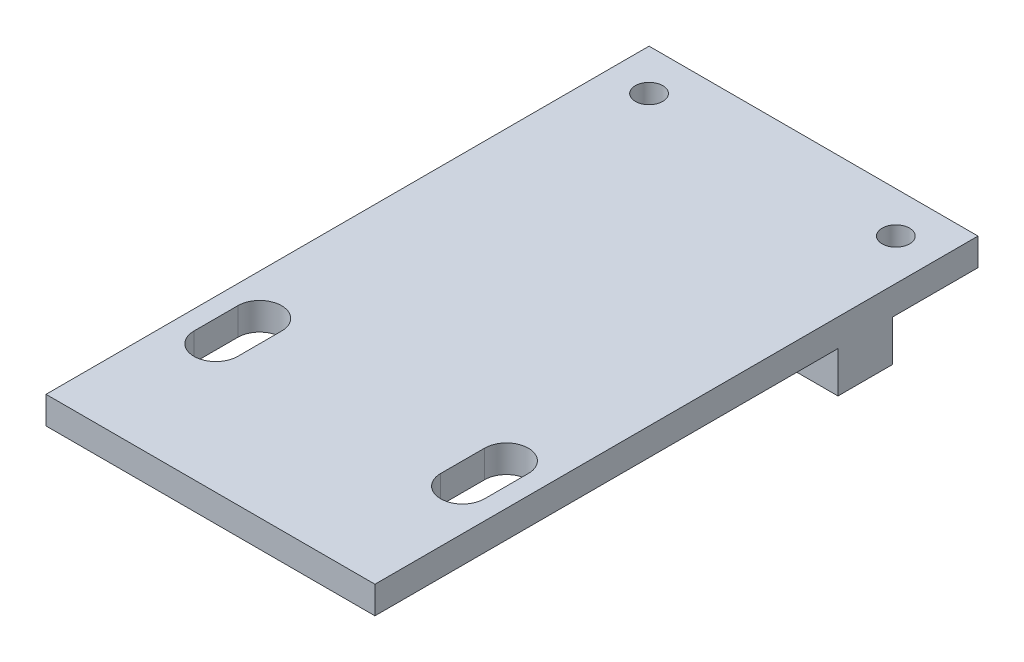
from build123d import *

# Parameters (mm, degrees)
SKETCH1_W           = 24
SKETCH1_H           = 48
BOSS_EXTRUDE1_DEPTH = 2
SKETCH2_R           = 1
CUT_EXTRUDE1_DEPTH  = 2
SKETCH3_R           = 1.6
CUT_EXTRUDE2_DEPTH  = 2
SKETCH5_W           = 4.002629444
SKETCH5_H           = 28.892829006
BOSS_EXTRUDE2_DEPTH = 3
SKETCH7_W           = 4.002629444
SKETCH7_H           = 6.221455563
CUT_EXTRUDE3_DEPTH  = 3
SKETCH8_W           = 10.000621013
SKETCH8_H           = 3.995270277
SKETCH8_W_2         = 9.996749543
BOSS_EXTRUDE3_DEPTH = 3
SKETCH9_W           = 24
SKETCH9_H           = 2
CUT_EXTRUDE4_DEPTH  = 4


with BuildPart() as part:
    # Sketch1 → Boss-Extrude1 (new body)
    with BuildSketch(Plane(origin=(0, 0, 0), x_dir=(1, 0, 0), z_dir=(0, 1, 0))):
        with Locations((12, 24)):
            Rectangle(SKETCH1_W, SKETCH1_H)
    extrude(amount=BOSS_EXTRUDE1_DEPTH)

    # Sketch2 → Cut-Extrude1 (cut)
    with BuildSketch(Plane(origin=(0, 2, 0), x_dir=(1, 0, 0), z_dir=(0, 1, 0))):
        with Locations(Location((2.995742756, 45.004810193, 0), (0, 0, 270))):
            Circle(SKETCH2_R)
        with Locations(Location((21.000528316, 45.004810193, 0), (0, 0, 270))):
            Circle(SKETCH2_R)
    extrude(amount=-CUT_EXTRUDE1_DEPTH, mode=Mode.SUBTRACT)

    # Sketch3 → Cut-Extrude2 (cut)
    with BuildSketch(Plane(origin=(0, 2, 0), x_dir=(1, 0, 0), z_dir=(0, 1, 0))):
        with Locations((2.997154371, 14.995076851)):
            Circle(SKETCH3_R)
        with Locations((2.997154371, 16.595076851)):
            Circle(SKETCH3_R)
        with Locations((2.997154371, 13.395076851)):
            Circle(SKETCH3_R)
        with BuildLine():
            ThreePointArc((1.611513725, 15.795076851), (1.451673049, 16.180966379), (1.397154371, 16.595076851))
            Line((1.397154371, 16.595076851), (1.397154371, 14.995076851))
            ThreePointArc((1.397154371, 14.995076851), (1.451673049, 15.409187323), (1.611513725, 15.795076851))
        make_face()
        with BuildLine():
            ThreePointArc((1.611513725, 14.195076851), (1.451673049, 14.580966379), (1.397154371, 14.995076851))
            Line((1.397154371, 14.995076851), (1.397154371, 13.395076851))
            ThreePointArc((1.397154371, 13.395076851), (1.451673049, 13.809187323), (1.611513725, 14.195076851))
        make_face()
        with BuildLine():
            Line((4.597154371, 13.395076851), (4.597154371, 14.995076851))
            ThreePointArc((4.597154371, 14.995076851), (4.542635694, 14.580966379), (4.382795018, 14.195076851))
            ThreePointArc((4.382795018, 14.195076851), (4.542635694, 13.809187323), (4.597154371, 13.395076851))
        make_face()
        with BuildLine():
            Line((4.597154371, 14.995076851), (4.597154371, 16.595076851))
            ThreePointArc((4.597154371, 16.595076851), (4.542635694, 16.180966379), (4.382795018, 15.795076851))
            ThreePointArc((4.382795018, 15.795076851), (4.542635694, 15.409187323), (4.597154371, 14.995076851))
        make_face()
        with Locations((21.000046924, 14.995076851)):
            Circle(SKETCH3_R)
        with Locations((21.000046924, 16.595076851)):
            Circle(SKETCH3_R)
        with Locations((21.000046924, 13.395076851)):
            Circle(SKETCH3_R)
        with BuildLine():
            Line((22.600046924, 13.395076851), (22.600046924, 14.995076851))
            ThreePointArc((22.600046924, 14.995076851), (22.545528247, 14.580966379), (22.385687571, 14.195076851))
            ThreePointArc((22.385687571, 14.195076851), (22.545528247, 13.809187323), (22.600046924, 13.395076851))
        make_face()
        with BuildLine():
            Line((22.600046924, 14.995076851), (22.600046924, 16.595076851))
            ThreePointArc((22.600046924, 16.595076851), (22.545528247, 16.180966379), (22.385687571, 15.795076851))
            ThreePointArc((22.385687571, 15.795076851), (22.545528247, 15.409187323), (22.600046924, 14.995076851))
        make_face()
        with BuildLine():
            ThreePointArc((19.614406278, 15.795076851), (19.454565602, 16.180966379), (19.400046924, 16.595076851))
            Line((19.400046924, 16.595076851), (19.400046924, 14.995076851))
            ThreePointArc((19.400046924, 14.995076851), (19.454565602, 15.409187323), (19.614406278, 15.795076851))
        make_face()
        with BuildLine():
            ThreePointArc((19.614406278, 14.195076851), (19.454565602, 14.580966379), (19.400046924, 14.995076851))
            Line((19.400046924, 14.995076851), (19.400046924, 13.395076851))
            ThreePointArc((19.400046924, 13.395076851), (19.454565602, 13.809187323), (19.614406278, 14.195076851))
        make_face()
    extrude(amount=-CUT_EXTRUDE2_DEPTH, mode=Mode.SUBTRACT)

    # Sketch5 → Boss-Extrude2 (add)
    with BuildSketch(Plane(origin=(0, 0, 0), x_dir=(-1, 0, 0), z_dir=(0, -1, 0))):
        with Locations((-11.998064265, 33.553585497)):
            Rectangle(SKETCH5_W, SKETCH5_H)
    extrude(amount=BOSS_EXTRUDE2_DEPTH)

    # Sketch7 → Cut-Extrude3 (cut)
    with BuildSketch(Plane(origin=(0, -3, 0), x_dir=(-1, 0, 0), z_dir=(0, -1, 0))):
        with Locations((-11.998064265, 44.889272218)):
            Rectangle(SKETCH7_W, SKETCH7_H)
    extrude(amount=-CUT_EXTRUDE3_DEPTH, mode=Mode.SUBTRACT)

    # Sketch8 → Boss-Extrude3 (add)
    with BuildSketch(Plane(origin=(0, 0, 0), x_dir=(-1, 0, 0), z_dir=(0, -1, 0))):
        with Locations((-18.999689494, 39.780909299)):
            Rectangle(SKETCH8_W, SKETCH8_H)
        with Locations((-4.998374771, 39.780909299)):
            Rectangle(SKETCH8_W_2, SKETCH8_H)
    extrude(amount=BOSS_EXTRUDE3_DEPTH)

    # Sketch9 → Cut-Extrude4 (cut)
    with BuildSketch(Plane.XY):
        with Locations((12, 1)):
            Rectangle(SKETCH9_W, SKETCH9_H)
    extrude(amount=-CUT_EXTRUDE4_DEPTH, mode=Mode.SUBTRACT)


solid = part.part
